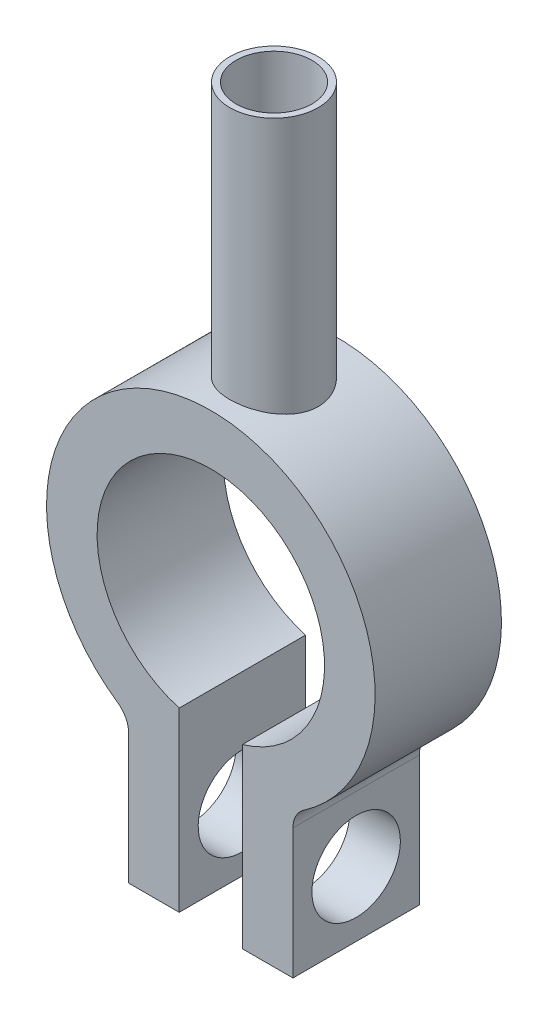
from build123d import *

# Parameters (mm, degrees)
SCHIZZO1_R                        = 13
SCHIZZO1_R_2                      = 9
ANELLO_DEPTH                      = 10
SCHIZZO2_W                        = 5
SCHIZZO2_H                        = 13
TAGLIOANELLO_DEPTH                = 21.928449536
SCHIZZO3_W                        = 4
SCHIZZO3_H                        = 14
BORDOVITEDESTRO_DEPTH             = 10
RACCORDODESTRO_R                  = 2
RACCORDOSINISTRO_R                = 2
SCHIZZO4_R                        = 3.5
FOROVITE_DEPTH                    = 32.513213586
AGGANCIOLONGHERONECODA_DEPTH      = 20
AGGANCIOLONGHERONECODA_DEPTH_BACK = 2
SCHIZZO5_R                        = 3.5
SCHIZZO5_R_2                      = 3


with BuildPart() as part:
    # Schizzo1 → Anello (new body)
    with BuildSketch(Plane.XY):
        Circle(SCHIZZO1_R)
        Circle(SCHIZZO1_R_2, mode=Mode.SUBTRACT)
    extrude(amount=ANELLO_DEPTH)

    # Schizzo2 → TaglioAnello (cut, through all)
    with BuildSketch(Plane.XY.offset(10)):
        with Locations((0, -6.5)):
            Rectangle(SCHIZZO2_W, SCHIZZO2_H)
    extrude(amount=-TAGLIOANELLO_DEPTH, mode=Mode.SUBTRACT)

    # Schizzo3 → BordoViteDestro (add)
    with BuildSketch(Plane.XY.offset(10)):
        with Locations((-4.5, -15.645808233)):
            Rectangle(SCHIZZO3_W, SCHIZZO3_H)
    bordovitedestro = extrude(amount=-BORDOVITEDESTRO_DEPTH)

    # BordoViteSinistro: BordoViteDestro across plane
    add(bordovitedestro.mirror(Plane(origin=(0, 0, 0), x_dir=(0, 0, 1), z_dir=(1, 0, 0))))

    # RaccordoDestro
    raccordodestro_edges = [part.edges().sort_by_distance(p)[0] for p in [
        (-6.5, -11.258330249, 5),
    ]]
    fillet(raccordodestro_edges, radius=RACCORDODESTRO_R)

    # RaccordoSinistro
    raccordosinistro_edges = [part.edges().sort_by_distance(p)[0] for p in [
        (6.5, -11.258330249, 5),
    ]]
    fillet(raccordosinistro_edges, radius=RACCORDOSINISTRO_R)

    # Schizzo4 → ForoVite (cut, through all)
    with BuildSketch(Plane(origin=(6.5, 0, 0), x_dir=(0, 0, -1), z_dir=(1, 0, 0))):
        with Locations(Location((-5, -17.502507664, 0), (0, 0, 90))):
            Circle(SCHIZZO4_R)
    extrude(amount=-FOROVITE_DEPTH, mode=Mode.SUBTRACT)


with BuildPart() as body_2:
    # Schizzo5 → AggancioLongheroneCoda (new, two sides: drawn at the far end of the back side and taken through both)
    with BuildSketch(Plane(origin=(0, 13, 0), x_dir=(1, 0, 0), z_dir=(0, 1, 0)).offset(-AGGANCIOLONGHERONECODA_DEPTH_BACK)):
        with Locations(Location((0, -5, 0), (0, 0, 270))):
            Circle(SCHIZZO5_R)
        with Locations(Location((0, -5, 0), (0, 0, 270))):
            Circle(SCHIZZO5_R_2, mode=Mode.SUBTRACT)
    extrude(amount=AGGANCIOLONGHERONECODA_DEPTH + AGGANCIOLONGHERONECODA_DEPTH_BACK)


solid = Compound([part.part, body_2.part])
